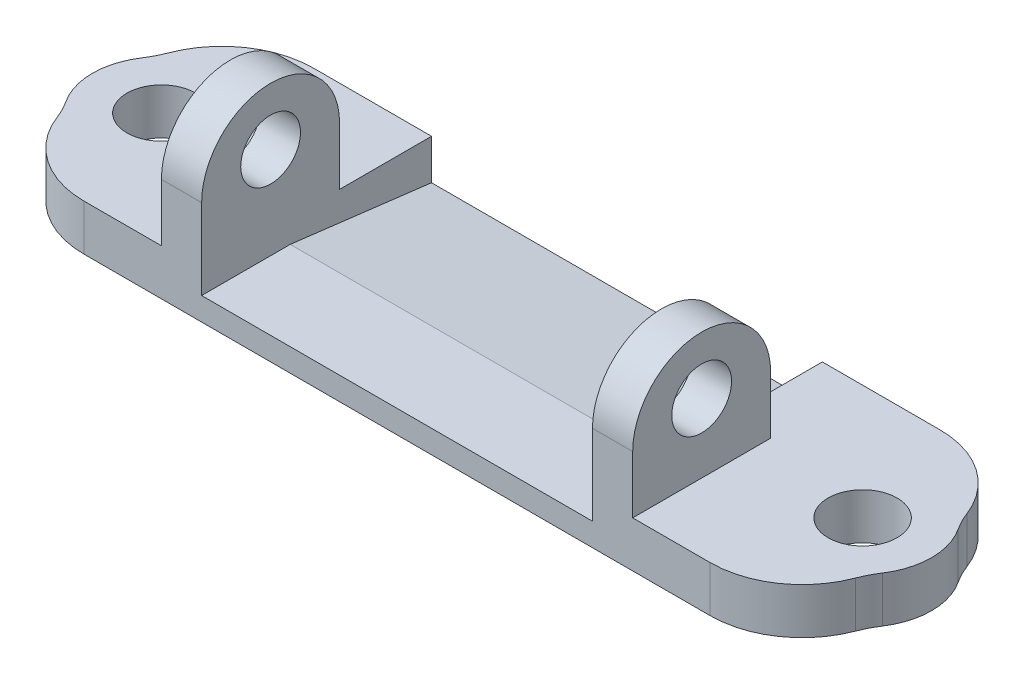
from build123d import *

# Parameters (mm, degrees)
BOSS_EXTRUDE1_DEPTH             = 4
CUT_EXTRUDE1_DEPTH              = 34
BOSS_EXTRUDE2_DEPTH             = 3.5
F_5_2_5_2_DIAMETER_HOLE1_REACH  = 64.241
F_5_2_5_2_DIAMETER_HOLE1_BORE_R = 2.6
F_6_0_6_DIAMETER_HOLE1_D        = 6
F_6_0_6_DIAMETER_HOLE1_DEPTH    = 15


with BuildPart() as part:
    # Sketch1 → Boss-Extrude1 (new body)
    with BuildSketch(Plane(origin=(0, 4, 0), x_dir=(1, 0, 0), z_dir=(0, 1, 0))):
        with BuildLine():
            Line((7.753999476, 0), (62.246000524, 0))
            ThreePointArc((62.246000524, 0), (66.787860981, 1.414295513), (69.723838222, 5.157124101))
            ThreePointArc((69.723838222, 5.157124101), (70.077199101, 5.953180748), (70.515003965, 6.706106372))
            ThreePointArc((70.515003965, 6.706106372), (71.5, 10), (70.515003965, 13.293893628))
            ThreePointArc((70.515003965, 13.293893628), (70.077199101, 14.046819252), (69.723838222, 14.842875899))
            ThreePointArc((69.723838222, 14.842875899), (66.787860981, 18.585704487), (62.246000524, 20))
            Line((62.246000524, 20), (52, 20))
            add(Edge.make_bspline(
                [(18, 20), (29.333333333, 20), (40.666666667, 20), (52, 20)],
                knots=[0, 0, 0, 0, 1, 1, 1, 1], degree=3))
            Line((18, 20), (7.753999476, 20))
            ThreePointArc((7.753999476, 20), (3.212139019, 18.585704487), (0.276161778, 14.842875899))
            ThreePointArc((0.276161778, 14.842875899), (-0.077199101, 14.046819252), (-0.515003965, 13.293893628))
            ThreePointArc((-0.515003965, 13.293893628), (-1.5, 10), (-0.515003965, 6.706106372))
            ThreePointArc((-0.515003965, 6.706106372), (-0.077199101, 5.953180748), (0.276161778, 5.157124101))
            ThreePointArc((0.276161778, 5.157124101), (3.212139019, 1.414295513), (7.753999476, 0))
        make_face()
    extrude(amount=-BOSS_EXTRUDE1_DEPTH)

    # Sketch2 → Cut-Extrude1 (cut)
    with BuildSketch(Plane(origin=(18, 0, 0), x_dir=(0, -1, 0), z_dir=(-1, 0, 0))):
        Polygon((-2, 0), (-4, 0), (-4, -20), (-0.499398694, -20), (-2, -7.707188193), align=None)
    extrude(amount=-CUT_EXTRUDE1_DEPTH, mode=Mode.SUBTRACT)

    # Sketch3 → Boss-Extrude2 (add)
    with BuildSketch(Plane(origin=(18, 0, 0), x_dir=(0, 0, -1), z_dir=(1, 0, 0))):
        with BuildLine():
            Line((0, 4), (12, 4))
            Line((12, 4), (12, 9))
            ThreePointArc((12, 9), (6, 15), (0, 9))
            Line((0, 9), (0, 4))
        make_face()
    boss_extrude2 = extrude(amount=-BOSS_EXTRUDE2_DEPTH)

    # Mirror1: Boss-Extrude2 across plane
    add(boss_extrude2.mirror(Plane.ZY.offset(-35)))

    # Ø5.2 (5.2) Diameter Hole1 bore → Ø5.2 (5.2) Diameter Hole1 (cut, up to next)
    with BuildSketch(Plane.ZY.offset(-14.5), mode=Mode.PRIVATE) as f_5_2_5_2_diameter_hole1_sk1:
        with Locations((-6, 10)):
            Circle(F_5_2_5_2_DIAMETER_HOLE1_BORE_R)
    f_5_2_5_2_diameter_hole1_tool1 = extrude(f_5_2_5_2_diameter_hole1_sk1.sketch, amount=-F_5_2_5_2_DIAMETER_HOLE1_REACH, mode=Mode.PRIVATE) & part.part
    f_5_2_5_2_diameter_hole1 = f_5_2_5_2_diameter_hole1_tool1.solids().sort_by_distance((14.5, 10, -6))[0]
    add(f_5_2_5_2_diameter_hole1, mode=Mode.SUBTRACT)

    # Ø6.0 (6) Diameter Hole1
    with Locations(Plane(origin=(0, 0, 0), x_dir=(-1, 0, 0), z_dir=(0, -1, 0))):
        with Locations((-4.5, 10)):
            f_6_0_6_diameter_hole1 = Hole(F_6_0_6_DIAMETER_HOLE1_D / 2, depth=F_6_0_6_DIAMETER_HOLE1_DEPTH)

    # Mirror2: Ø5.2 (5.2) Diameter Hole1, Ø6.0 (6) Diameter Hole1 across plane
    add(f_5_2_5_2_diameter_hole1.mirror(Plane.ZY.offset(-35)), mode=Mode.SUBTRACT)
    add(f_6_0_6_diameter_hole1.mirror(Plane.ZY.offset(-35)), mode=Mode.SUBTRACT)


solid = part.part
